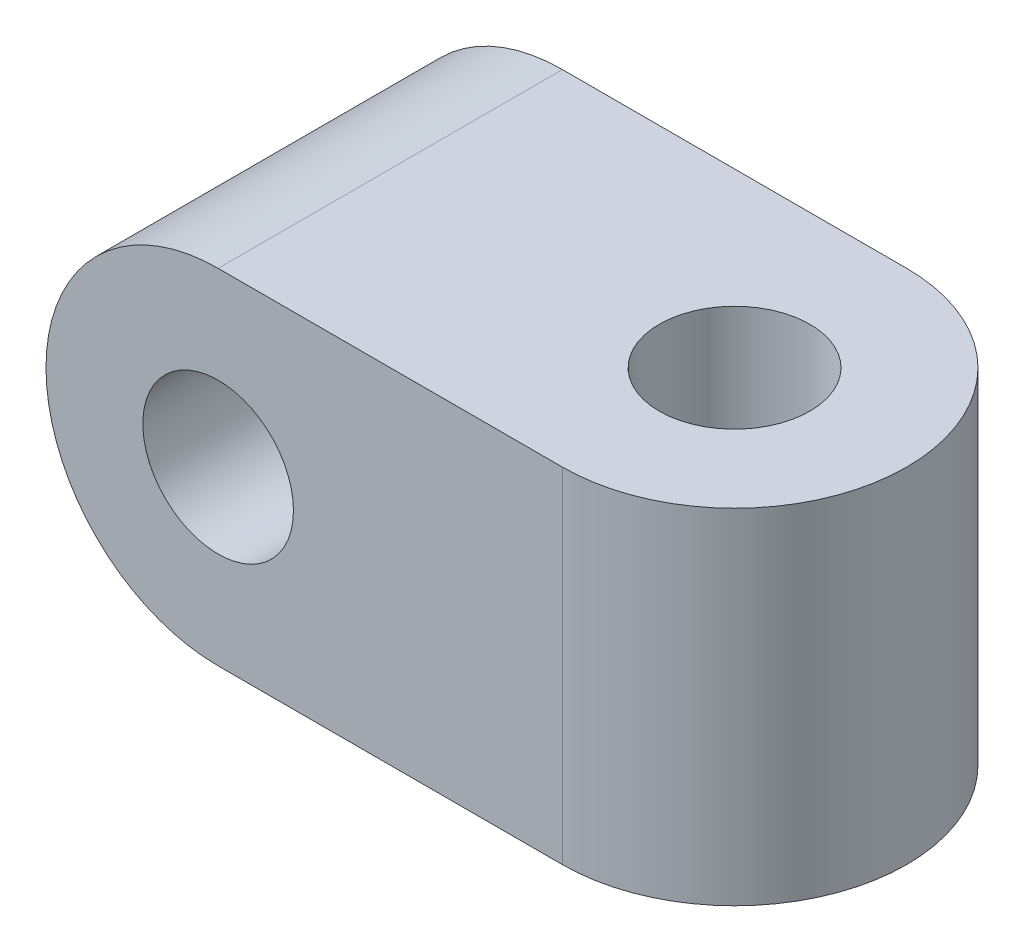
from build123d import *

# Parameters (mm, degrees)
SKETCH1_R               = 5.55625
BOSS_EXTRUDE1_DEPTH     = 25.4
CUT_EXTRUDE1_DEPTH      = 44.994090512
CUT_EXTRUDE1_DEPTH_BACK = 44.994090512
SKETCH2_R               = 5.55625


with BuildPart() as part:
    # Sketch1 → Boss-Extrude1 (new body)
    with BuildSketch(Plane.XY):
        with BuildLine():
            ThreePointArc((-25.4, 0), (-21.680256121, -8.980256121), (-12.7, -12.7))
            Line((-12.7, -12.7), (25.4, -12.7))
            Line((25.4, -12.7), (25.4, 12.7))
            Line((25.4, 12.7), (-12.7, 12.7))
            ThreePointArc((-12.7, 12.7), (-21.680256121, 8.980256121), (-25.4, 0))
        make_face()
        with Locations((-12.7, 0)):
            Circle(SKETCH1_R, mode=Mode.SUBTRACT)
    extrude(amount=BOSS_EXTRUDE1_DEPTH)

    # Sketch2 → Cut-Extrude1 (cut, two sides: drawn at the far end of the back side and taken through both)
    with BuildSketch(Plane(origin=(0, 12.7, 0), x_dir=(1, 0, 0), z_dir=(0, 1, 0)).offset(-CUT_EXTRUDE1_DEPTH_BACK)):
        with Locations(Location((12.7, -12.7, 0), (0, 0, 270))):
            Circle(SKETCH2_R)
        with BuildLine():
            Line((25.4, 0), (12.7, 0))
            ThreePointArc((12.7, 0), (21.680256121, -3.719743879), (25.4, -12.7))
            Line((25.4, -12.7), (25.4, 0))
        make_face()
        with BuildLine():
            Line((25.4, -25.4), (25.4, -12.7))
            ThreePointArc((25.4, -12.7), (21.680256121, -21.680256121), (12.7, -25.4))
            Line((12.7, -25.4), (25.4, -25.4))
        make_face()
    extrude(amount=CUT_EXTRUDE1_DEPTH + CUT_EXTRUDE1_DEPTH_BACK, mode=Mode.SUBTRACT)


solid = part.part
